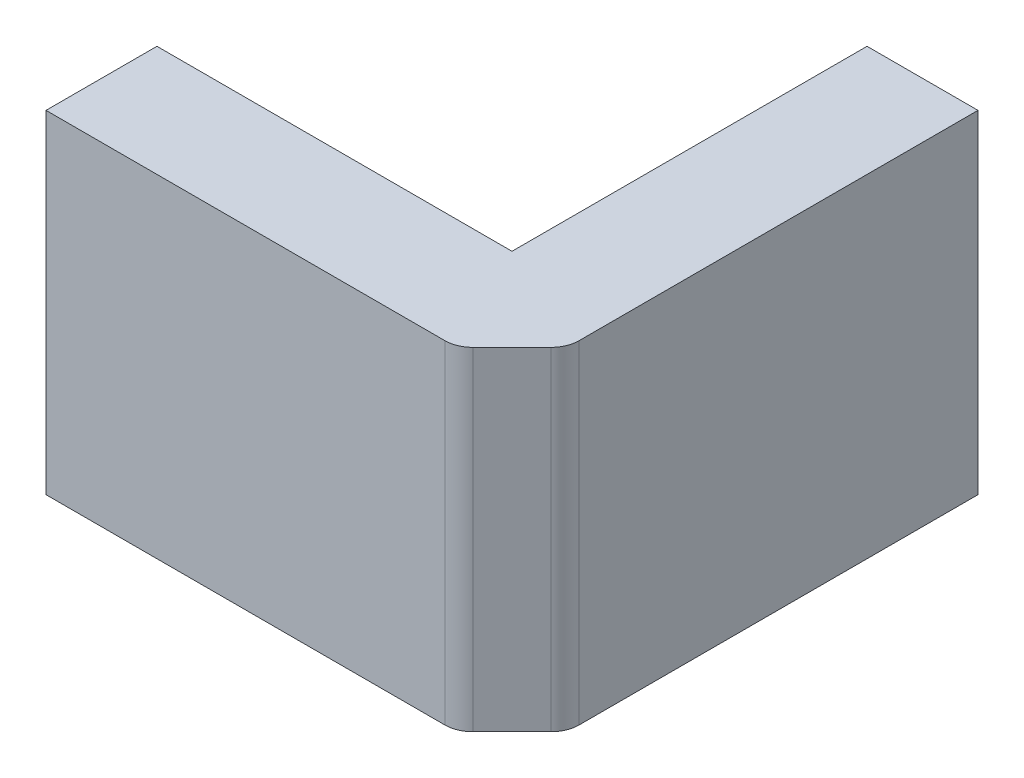
from build123d import *

# Parameters (mm, degrees)
BOSS_EXTRUDE1_DEPTH = 60
CHAMFER1_SIZE       = 10
FILLET1_R           = 5


with BuildPart() as part:
    # Sketch1 → Boss-Extrude1 (new body)
    with BuildSketch(Plane(origin=(0, 0, 0), x_dir=(1, 0, 0), z_dir=(0, 1, 0))):
        Polygon((22, 42), (22, -22), (-42, -22), (-42, -42), (42, -42), (42, 42), align=None)
    extrude(amount=BOSS_EXTRUDE1_DEPTH)

    # Chamfer1
    chamfer1_edges = [part.edges().sort_by_distance(p)[0] for p in [
        (42, 30, 42),
    ]]
    chamfer(chamfer1_edges, length=CHAMFER1_SIZE)

    # Fillet1
    fillet1_edges = [part.edges().sort_by_distance(p)[0] for p in [
        (42, 30, 32),
        (32, 30, 42),
    ]]
    fillet(fillet1_edges, radius=FILLET1_R)


solid = part.part
